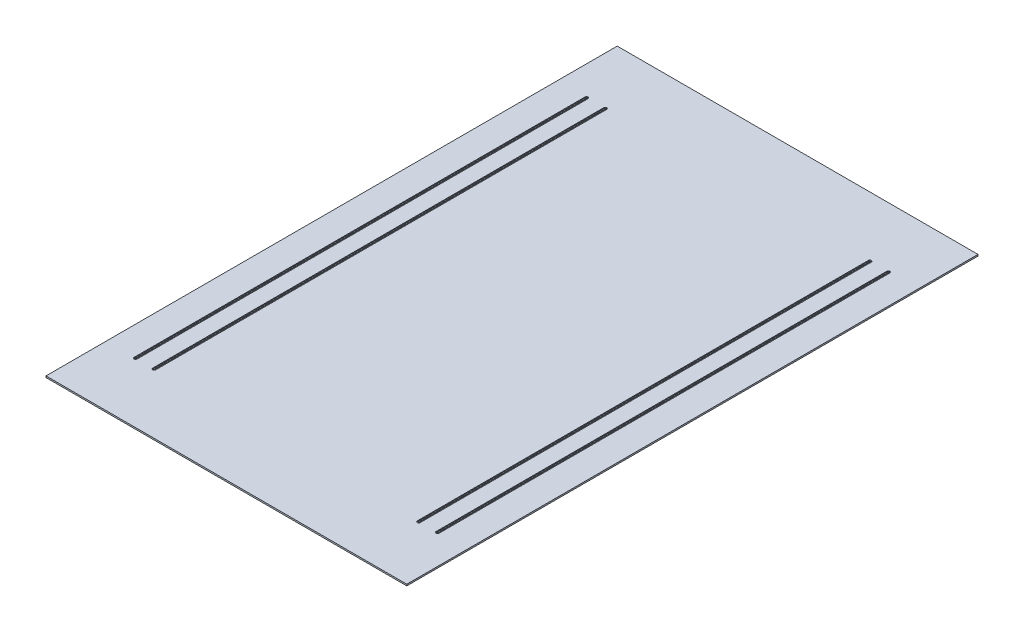
from build123d import *

# Parameters (mm, degrees)
SKETCH1_W           = 1200
SKETCH1_H           = 1900
BOSS_EXTRUDE1_DEPTH = 5
CUT_EXTRUDE1_DEPTH  = 5
CUT_EXTRUDE2_DEPTH  = 3


with BuildPart() as part:
    # Sketch1 → Boss-Extrude1 (new body)
    with BuildSketch(Plane(origin=(0, 0, 0), x_dir=(1, 0, 0), z_dir=(0, 1, 0))):
        Rectangle(SKETCH1_W, SKETCH1_H)
    extrude(amount=BOSS_EXTRUDE1_DEPTH)

    # Sketch2 → Cut-Extrude1 (cut)
    with BuildSketch(Plane(origin=(0, 5, 0), x_dir=(1, 0, 0), z_dir=(0, 1, 0))):
        with BuildLine():
            Line((-500, 750), (-500, -750))
            ThreePointArc((-500, -750), (-502, -752), (-504, -750))
            Line((-504, -750), (-504, 750))
            ThreePointArc((-504, 750), (-502, 752), (-500, 750))
        make_face()
        with BuildLine():
            Line((-438, 750), (-438, -750))
            ThreePointArc((-438, -750), (-440, -752), (-442, -750))
            Line((-442, -750), (-442, 750))
            ThreePointArc((-442, 750), (-440, 752), (-438, 750))
        make_face()
        with BuildLine():
            Line((438, 750), (438, -750))
            ThreePointArc((438, -750), (440, -752), (442, -750))
            Line((442, -750), (442, 750))
            ThreePointArc((442, 750), (440, 752), (438, 750))
        make_face()
        with BuildLine():
            Line((500, 750), (500, -750))
            ThreePointArc((500, -750), (502, -752), (504, -750))
            Line((504, -750), (504, 750))
            ThreePointArc((504, 750), (502, 752), (500, 750))
        make_face()
    extrude(amount=-CUT_EXTRUDE1_DEPTH, mode=Mode.SUBTRACT)

    # Sketch4 → Cut-Extrude2 (cut)
    # profile 1 of 4: a face of its own
    with BuildSketch(Plane(origin=(0, 5, 0), x_dir=(1, 0, 0), z_dir=(0, 1, 0))):
        with BuildLine():
            Line((-435, -750), (-435, 750))
            ThreePointArc((-435, 750), (-440, 755), (-445, 750))
            Line((-445, 750), (-445, -750))
            ThreePointArc((-445, -750), (-440, -755), (-435, -750))
        make_face()
        with BuildLine():
            Line((-438, -750), (-438, 750))
            ThreePointArc((-438, 750), (-440, 752), (-442, 750))
            Line((-442, 750), (-442, -750))
            ThreePointArc((-442, -750), (-440, -752), (-438, -750))
        make_face(mode=Mode.SUBTRACT)
    # profile 2 of 4: a face of its own
    with BuildSketch(Plane(origin=(0, 5, 0), x_dir=(1, 0, 0), z_dir=(0, 1, 0))):
        with BuildLine():
            Line((-497, -750), (-497, 750))
            ThreePointArc((-497, 750), (-502, 755), (-507, 750))
            Line((-507, 750), (-507, -750))
            ThreePointArc((-507, -750), (-502, -755), (-497, -750))
        make_face()
        with BuildLine():
            Line((-500, -750), (-500, 750))
            ThreePointArc((-500, 750), (-502, 752), (-504, 750))
            Line((-504, 750), (-504, -750))
            ThreePointArc((-504, -750), (-502, -752), (-500, -750))
        make_face(mode=Mode.SUBTRACT)
    # profile 3 of 4: a face of its own
    with BuildSketch(Plane(origin=(0, 5, 0), x_dir=(1, 0, 0), z_dir=(0, 1, 0))):
        with BuildLine():
            Line((497, 750), (497, -750))
            ThreePointArc((497, -750), (502, -755), (507, -750))
            Line((507, -750), (507, 750))
            ThreePointArc((507, 750), (502, 755), (497, 750))
        make_face()
        with BuildLine():
            Line((500, 750), (500, -750))
            ThreePointArc((500, -750), (502, -752), (504, -750))
            Line((504, -750), (504, 750))
            ThreePointArc((504, 750), (502, 752), (500, 750))
        make_face(mode=Mode.SUBTRACT)
    # profile 4 of 4: a face of its own
    with BuildSketch(Plane(origin=(0, 5, 0), x_dir=(1, 0, 0), z_dir=(0, 1, 0))):
        with BuildLine():
            Line((435, 750), (435, -750))
            ThreePointArc((435, -750), (440, -755), (445, -750))
            Line((445, -750), (445, 750))
            ThreePointArc((445, 750), (440, 755), (435, 750))
        make_face()
        with BuildLine():
            Line((438, 750), (438, -750))
            ThreePointArc((438, -750), (440, -752), (442, -750))
            Line((442, -750), (442, 750))
            ThreePointArc((442, 750), (440, 752), (438, 750))
        make_face(mode=Mode.SUBTRACT)
    extrude(amount=-CUT_EXTRUDE2_DEPTH, mode=Mode.SUBTRACT)


solid = part.part
